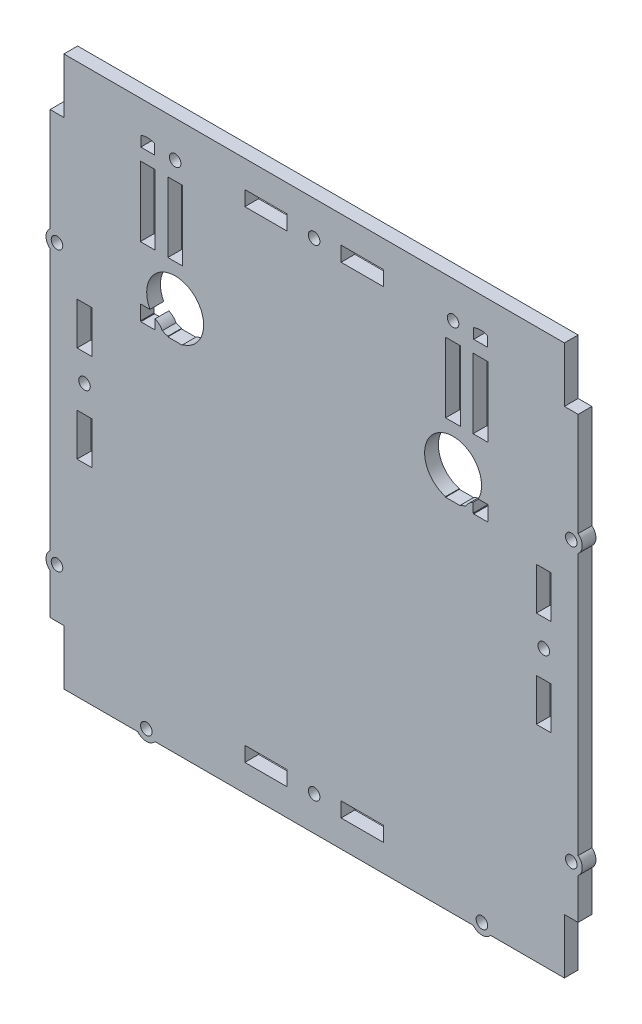
from build123d import *

# Parameters (mm, degrees)
BOSS_EXTRUDE1_DEPTH = 5
SKETCH2_R           = 2.1
CUT_EXTRUDE1_DEPTH  = 10
BOSS_EXTRUDE2_DEPTH = 5
BOSS_EXTRUDE3_DEPTH = 5
SKETCH5_R           = 2.1
CUT_EXTRUDE2_DEPTH  = 5
BOSS_EXTRUDE4_DEPTH = 5
SKETCH7_W           = 5.4
SKETCH7_H           = 25.4
SKETCH7_H_2         = 5.4
CUT_EXTRUDE4_DEPTH  = 5
SKETCH8_R           = 2.1
SKETCH8_W           = 15.4
SKETCH8_H           = 5.4
SKETCH8_W_2         = 15
SKETCH8_H_2         = 5
SKETCH8_W_3         = 5.4
SKETCH8_H_3         = 15.4
CUT_EXTRUDE5_DEPTH  = 5
SKETCH9_W           = 15
SKETCH9_H           = 5
CUT_EXTRUDE6_DEPTH  = 10
SKETCH10_R          = 2.1
CUT_EXTRUDE7_DEPTH  = 10


with BuildPart() as part:
    # Sketch1 → Boss-Extrude1 (new body)
    with BuildSketch(Plane.XY):
        Polygon((-182, 200), (-182, 180), (-187, 180), (-187, 20), (-182, 20), (-182, 0), (0, 0), (0, 20), (5, 20), (5, 180), (0, 180), (0, 200), align=None)
    extrude(amount=BOSS_EXTRUDE1_DEPTH)

    # Sketch2 → Cut-Extrude1 (cut)
    with BuildSketch(Plane(origin=(0, 0, 0), x_dir=(-1, 0, 0), z_dir=(0, 0, -1))):
        with Locations((-2.5, 139.3)):
            Circle(SKETCH2_R)
        with Locations((-2.5, 37.9)):
            Circle(SKETCH2_R)
        with Locations(Location((184.5, 37.9, 0), (0, 0, 180))):
            Circle(SKETCH2_R)
        with Locations(Location((184.5, 139.3, 0), (0, 0, 180))):
            Circle(SKETCH2_R)
    extrude(amount=-CUT_EXTRUDE1_DEPTH, mode=Mode.SUBTRACT)

    # Sketch3 → Boss-Extrude2 (add)
    with BuildSketch(Plane(origin=(0, 0, 0), x_dir=(-1, 0, 0), z_dir=(0, 0, -1))):
        with BuildLine():
            Line((-5, 136.177501001), (-5, 142.422498999))
            ThreePointArc((-5, 142.422498999), (-6.5, 139.3), (-5, 136.177501001))
        make_face()
    boss_extrude2 = extrude(amount=-BOSS_EXTRUDE2_DEPTH)

    # Sketch4 → Boss-Extrude3 (add)
    with BuildSketch(Plane(origin=(0, 0, 0), x_dir=(-1, 0, 0), z_dir=(0, 0, -1))):
        with BuildLine():
            Line((-5, 34.777501001), (-5, 41.022498999))
            ThreePointArc((-5, 41.022498999), (-6.5, 37.9), (-5, 34.777501001))
        make_face()
    boss_extrude3 = extrude(amount=-BOSS_EXTRUDE3_DEPTH)

    # Mirror1: Boss-Extrude2, Boss-Extrude3 across plane
    add(boss_extrude2.mirror(Plane.ZY.offset(91)))
    add(boss_extrude3.mirror(Plane.ZY.offset(91)))

    # Sketch5 → Cut-Extrude2 (cut)
    with BuildSketch(Plane(origin=(0, 0, 0), x_dir=(-1, 0, 0), z_dir=(0, 0, -1))):
        with Locations((30, 2.5)):
            Circle(SKETCH5_R)
        with Locations((152, 2.5)):
            Circle(SKETCH5_R)
    extrude(amount=-CUT_EXTRUDE2_DEPTH, mode=Mode.SUBTRACT)

    # Sketch6 → Boss-Extrude4 (add)
    with BuildSketch(Plane(origin=(0, 0, 0), x_dir=(-1, 0, 0), z_dir=(0, 0, -1))):
        with BuildLine():
            Line((155.122498999, 0), (148.877501001, 0))
            ThreePointArc((148.877501001, 0), (152, -1.5), (155.122498999, 0))
        make_face()
        with BuildLine():
            Line((33.122498999, 0), (26.877501001, 0))
            ThreePointArc((26.877501001, 0), (30, -1.5), (33.122498999, 0))
        make_face()
    extrude(amount=-BOSS_EXTRUDE4_DEPTH)

    # Sketch7 → Cut-Extrude4 (cut)
    with BuildSketch(Plane.XY.offset(5)):
        with Locations((-30.5, 167.5)):
            Rectangle(SKETCH7_W, SKETCH7_H)
        with Locations((-40.5, 167.5)):
            Rectangle(SKETCH7_W, SKETCH7_H)
        with Locations((-30.5, 132.5)):
            Rectangle(SKETCH7_W, SKETCH7_H_2)
        with Locations((-40.5, 132.5)):
            Rectangle(SKETCH7_W, SKETCH7_H_2)
    cut_extrude4 = extrude(amount=-CUT_EXTRUDE4_DEPTH, mode=Mode.SUBTRACT)

    # Mirror2: Cut-Extrude4 across plane
    add(cut_extrude4.mirror(Plane.ZY.offset(91)), mode=Mode.SUBTRACT)

    # Sketch8 → Cut-Extrude5 (cut)
    # profile 1 of 12: a face of its own
    with BuildSketch(Plane(origin=(0, 0, 0), x_dir=(-1, 0, 0), z_dir=(0, 0, -1))):
        with Locations((90.999998379, 12.5)):
            Circle(SKETCH8_R)
    # profile 2 of 12: a face of its own
    with BuildSketch(Plane(origin=(0, 0, 0), x_dir=(-1, 0, 0), z_dir=(0, 0, -1))):
        with Locations(Location((90.999998379, 187.5, 0), (0, 0, 180))):
            Circle(SKETCH8_R)
    # profile 3 of 12: a face of its own
    with BuildSketch(Plane(origin=(0, 0, 0), x_dir=(-1, 0, 0), z_dir=(0, 0, -1))):
        with Locations((174.499996757, 100)):
            Circle(SKETCH8_R)
    # profile 4 of 12: a face of its own
    with BuildSketch(Plane(origin=(0, 0, 0), x_dir=(-1, 0, 0), z_dir=(0, 0, -1))):
        with Locations(Location((7.5, 100, 0), (0, 0, 180))):
            Circle(SKETCH8_R)
    # profile 5 of 12: a face of its own
    with BuildSketch(Plane(origin=(0, 0, 0), x_dir=(-1, 0, 0), z_dir=(0, 0, -1))):
        with Locations((108.499998379, 187.5)):
            Rectangle(SKETCH8_W, SKETCH8_H)
    # profile 6 of 12: a face of its own
    with BuildSketch(Plane(origin=(0, 0, 0), x_dir=(-1, 0, 0), z_dir=(0, 0, -1))):
        with Locations((73.499998379, 12.5)):
            Rectangle(SKETCH8_W, SKETCH8_H)
        with Locations((73.499998379, 12.5)):
            Rectangle(SKETCH8_W_2, SKETCH8_H_2, mode=Mode.SUBTRACT)
    # profile 7 of 12: a face of its own
    with BuildSketch(Plane(origin=(0, 0, 0), x_dir=(-1, 0, 0), z_dir=(0, 0, -1))):
        with Locations((73.499998379, 187.5)):
            Rectangle(SKETCH8_W, SKETCH8_H)
    # profile 8 of 12: a face of its own
    with BuildSketch(Plane(origin=(0, 0, 0), x_dir=(-1, 0, 0), z_dir=(0, 0, -1))):
        with Locations((108.499998379, 12.5)):
            Rectangle(SKETCH8_W, SKETCH8_H)
    # profile 9 of 12: a face of its own
    with BuildSketch(Plane(origin=(0, 0, 0), x_dir=(-1, 0, 0), z_dir=(0, 0, -1))):
        with Locations((174.499996757, 82.5)):
            Rectangle(SKETCH8_W_3, SKETCH8_H_3)
    # profile 10 of 12: a face of its own
    with BuildSketch(Plane(origin=(0, 0, 0), x_dir=(-1, 0, 0), z_dir=(0, 0, -1))):
        with Locations((174.499996757, 117.5)):
            Rectangle(SKETCH8_W_3, SKETCH8_H_3)
    # profile 11 of 12: a face of its own
    with BuildSketch(Plane(origin=(0, 0, 0), x_dir=(-1, 0, 0), z_dir=(0, 0, -1))):
        with Locations((7.5, 82.5)):
            Rectangle(SKETCH8_W_3, SKETCH8_H_3)
    # profile 12 of 12: a face of its own
    with BuildSketch(Plane(origin=(0, 0, 0), x_dir=(-1, 0, 0), z_dir=(0, 0, -1))):
        with Locations((7.5, 117.5)):
            Rectangle(SKETCH8_W_3, SKETCH8_H_3)
    extrude(amount=-CUT_EXTRUDE5_DEPTH, mode=Mode.SUBTRACT)


with BuildPart() as cut_extrude5_piece_1:
    # of the separate pieces the step leaves, piece 1, a body of its own (cut_extrude5_pieces)
    add(part.part.solids().sort_by_distance((-182, 200, 0))[0])

    # Sketch10 → Cut-Extrude7 (cut)
    with BuildSketch(Plane.XY.offset(5)):
        with BuildLine():
            Line((-148.8, 135.2), (-148.8, 133.208307979))
            ThreePointArc((-148.8, 133.208307979), (-147.314689345, 132.176321717), (-146.193604234, 130.757057274))
            ThreePointArc((-146.193604234, 130.757057274), (-145.216422795, 130.325730949), (-144.2, 129.997385607))
            Line((-144.2, 129.997385607), (-144.2, 135.2))
            Line((-144.2, 135.2), (-138.8, 135.2))
            Line((-138.8, 135.2), (-138.8, 130.013594506))
            ThreePointArc((-138.8, 130.013594506), (-137.394509388, 149.490991099), (-150.702850957, 135.2))
            Line((-150.702850957, 135.2), (-148.8, 135.2))
        make_face()
        Polygon((-149.030035391, 129.647109894), (-149.030035433, 129.8), (-154.030035433, 129.8), (-154.030035391, 129.647108503), align=None)
        with Locations((-141.529997703, 186.747164896)):
            Circle(SKETCH10_R)
        with BuildLine():
            Line((-149.030050697, 184.647109894), (-149.030051718, 188.316347969))
            ThreePointArc((-149.030051718, 188.316347969), (-151.530056924, 188.847109198), (-154.030051718, 188.316298928))
            Line((-154.030051718, 188.316298928), (-154.030050697, 184.647108503))
            Line((-154.030050697, 184.647108503), (-149.030050697, 184.647109894))
        make_face()
    cut_extrude7 = extrude(amount=-CUT_EXTRUDE7_DEPTH, mode=Mode.SUBTRACT)

    # Mirror3: Cut-Extrude7 across plane
    add(cut_extrude7.mirror(Plane(origin=(-91, 0, 0), x_dir=(0, 0, 1), z_dir=(1, 0, 0))), mode=Mode.SUBTRACT)


with BuildPart() as cut_extrude5_piece_2:
    # of the separate pieces the step leaves, piece 2, a body of its own (cut_extrude5_pieces)
    add(part.part.solids().sort_by_distance((-80.999998379, 10, 0))[0])

    # Sketch9 → Cut-Extrude6 (cut)
    with BuildSketch(Plane.XY.offset(5)):
        with Locations((-73.499998379, 12.5)):
            Rectangle(SKETCH9_W, SKETCH9_H)
    extrude(amount=-CUT_EXTRUDE6_DEPTH, mode=Mode.SUBTRACT)


solid = cut_extrude5_piece_1.part
